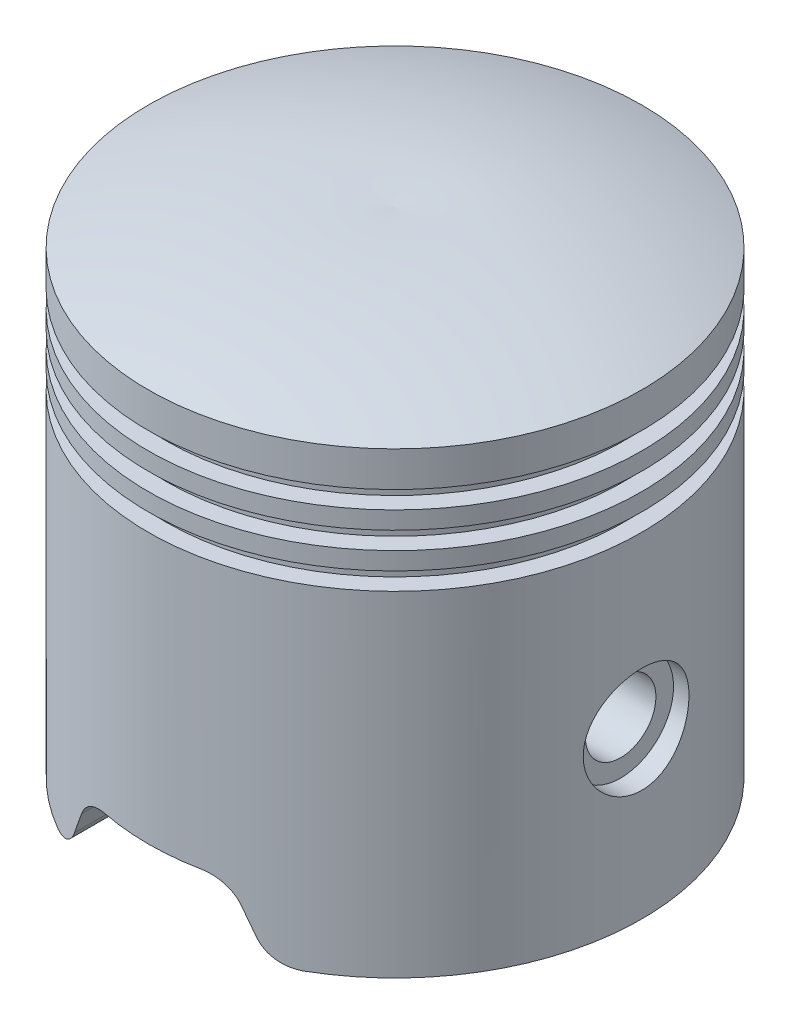
from build123d import *

# Parameters (mm, degrees)
CUT_EXTRUDE1_DEPTH  = 50
FILLET1_R           = 5
SKETCH4_R           = 7.5
CUT_EXTRUDE2_DEPTH  = 3
SKETCH6_R           = 5
CUT_EXTRUDE3_DEPTH  = 21
SKETCH7_R           = 6
BOSS_EXTRUDE1_DEPTH = 62
CUT_EXTRUDE4_START  = -100
SKETCH8_R           = 5
CUT_EXTRUDE4_DEPTH  = 100


with BuildPart() as part:
    # Sketch1 → Revolve1 (revolve)
    with BuildSketch(Plane.XY, mode=Mode.PRIVATE) as revolve1_sk:
        with BuildLine():
            Line((35, 65), (35, 60))
            Line((35, 60), (32.5, 60))
            Line((32.5, 60), (32.5, 57.5))
            Line((32.5, 57.5), (35, 57.5))
            Line((35, 57.5), (35, 55))
            Line((35, 55), (32.5, 55))
            Line((32.5, 55), (32.5, 52.5))
            Line((32.5, 52.5), (35, 52.5))
            Line((35, 52.5), (35, 50))
            Line((35, 50), (32.5, 50))
            Line((32.5, 50), (32.5, 47.5))
            Line((32.5, 47.5), (35, 47.5))
            Line((35, 47.5), (35, 0))
            Line((35, 0), (29, 0))
            Line((29, 0), (29, 41.5))
            Line((29, 41.5), (26.5, 41.5))
            Line((26.5, 41.5), (26.5, 51.25))
            Line((26.5, 51.25), (26.5, 56.25))
            Line((26.5, 56.25), (26.5, 60.153370447))
            Line((26.5, 60.153370447), (0, 63.939084733))
            Line((0, 63.939084733), (0, 70))
            ThreePointArc((0, 70), (17.762839264, 69.339874847), (35, 65))
        make_face()
    revolve(revolve1_sk.sketch.rotate(Axis((0, 0, 0), (0, 1, 0)), 90), axis=Axis((0, 0, 0), (0, 1, 0)))

    # Sketch2 → Cut-Extrude1 (cut, symmetric)
    with BuildSketch(Plane.XY):
        Polygon((-10, 9.214548861), (10, 9.214548861), (14.296814701, 0), (14.296814701, -4.920765988), (0.577416947, -4.920765988), (-8.331342859, -4.920765988), (-14.2968147, 0), align=None)
    extrude(amount=CUT_EXTRUDE1_DEPTH, both=True, mode=Mode.SUBTRACT)

    # Fillet1
    fillet1_edges = [part.edges().sort_by_distance(p)[0] for p in [
        (14.296814701, 0, -28.588901432),
        (14.296814701, 0, 28.588901432),
        (10, 9.214548861, 30.38116742),
        (10, 9.214548861, -30.38116742),
        (-14.2968147, 0, 28.588901432),
        (-14.2968147, 0, -28.588901432),
        (-10, 9.214548861, 30.38116742),
        (-10, 9.214548861, -30.38116742),
    ]]
    fillet(fillet1_edges, radius=FILLET1_R)

    # Sketch4 → Cut-Extrude2 (cut)
    with BuildSketch(Plane.ZY.offset(35)):
        with Locations((0, 23.312730986)):
            Circle(SKETCH4_R)
    cut_extrude2 = extrude(amount=-CUT_EXTRUDE2_DEPTH, mode=Mode.SUBTRACT)

    # Sketch6 → Cut-Extrude3 (cut)
    with BuildSketch(Plane.ZY.offset(32)):
        with Locations((0, 23.312730986)):
            Circle(SKETCH6_R)
    cut_extrude3 = extrude(amount=-CUT_EXTRUDE3_DEPTH, mode=Mode.SUBTRACT)

    # Mirror1: Cut-Extrude2, Cut-Extrude3 across plane
    add(cut_extrude2.mirror(Plane(origin=(0, 0, 0), x_dir=(0, 0, 1), z_dir=(1, 0, 0))), mode=Mode.SUBTRACT)
    add(cut_extrude3.mirror(Plane(origin=(0, 0, 0), x_dir=(0, 0, 1), z_dir=(1, 0, 0))), mode=Mode.SUBTRACT)

    # Sketch7 → Boss-Extrude1 (add)
    with BuildSketch(Plane(origin=(32, 0, 0), x_dir=(0, 0, -1), z_dir=(1, 0, 0))):
        with Locations((0, 23.312730986)):
            Circle(SKETCH7_R)
    extrude(amount=-BOSS_EXTRUDE1_DEPTH)

    # Sketch8 → Cut-Extrude4 (cut)
    with BuildSketch(Plane(origin=(32, 0, 0), x_dir=(0, 0, -1), z_dir=(1, 0, 0)).offset(CUT_EXTRUDE4_START)):
        with Locations(Location((0, 23.312730986, 0), (0, 0, 180))):
            Circle(SKETCH8_R)
    extrude(amount=CUT_EXTRUDE4_DEPTH, mode=Mode.SUBTRACT)


solid = part.part
